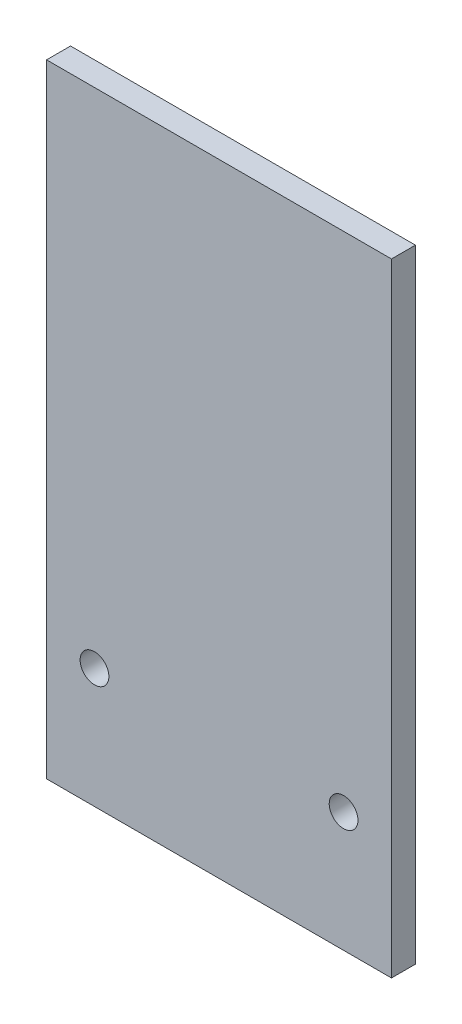
from build123d import *

# Parameters (mm, degrees)
SKETCH1_W           = 72
SKETCH1_H           = 130
BOSS_EXTRUDE1_DEPTH = 5
SKETCH2_R           = 3
CUT_EXTRUDE1_DEPTH  = 5


with BuildPart() as part:
    # Sketch1 → Boss-Extrude1 (new body)
    with BuildSketch(Plane.XY):
        Rectangle(SKETCH1_W, SKETCH1_H)
    extrude(amount=BOSS_EXTRUDE1_DEPTH)

    # Sketch2 → Cut-Extrude1 (cut)
    with BuildSketch(Plane.XY.offset(5)):
        with Locations((-26, -40)):
            Circle(SKETCH2_R)
        with Locations(Location((26, -40, 0), (0, 0, 180))):
            Circle(SKETCH2_R)
    extrude(amount=-CUT_EXTRUDE1_DEPTH, mode=Mode.SUBTRACT)


solid = part.part
